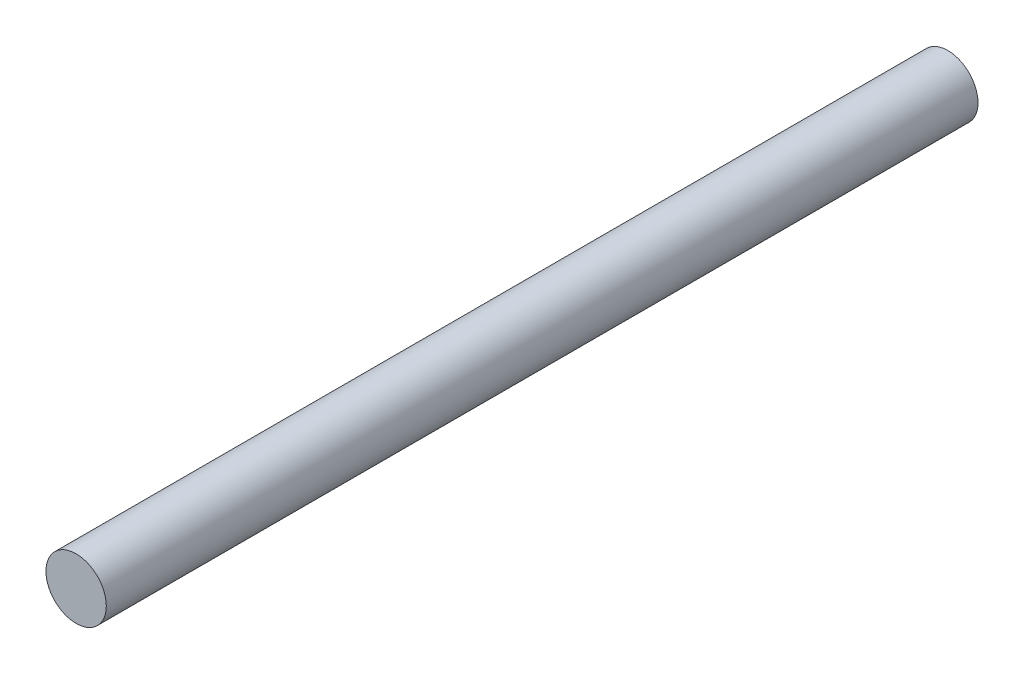
from build123d import *

# Parameters (mm, degrees)
SKETCH1_R           = 2.25
BOSS_EXTRUDE1_DEPTH = 65


with BuildPart() as part:
    # Sketch1 → Boss-Extrude1 (new body)
    with BuildSketch(Plane.XY):
        Circle(SKETCH1_R)
    extrude(amount=BOSS_EXTRUDE1_DEPTH)


solid = part.part
